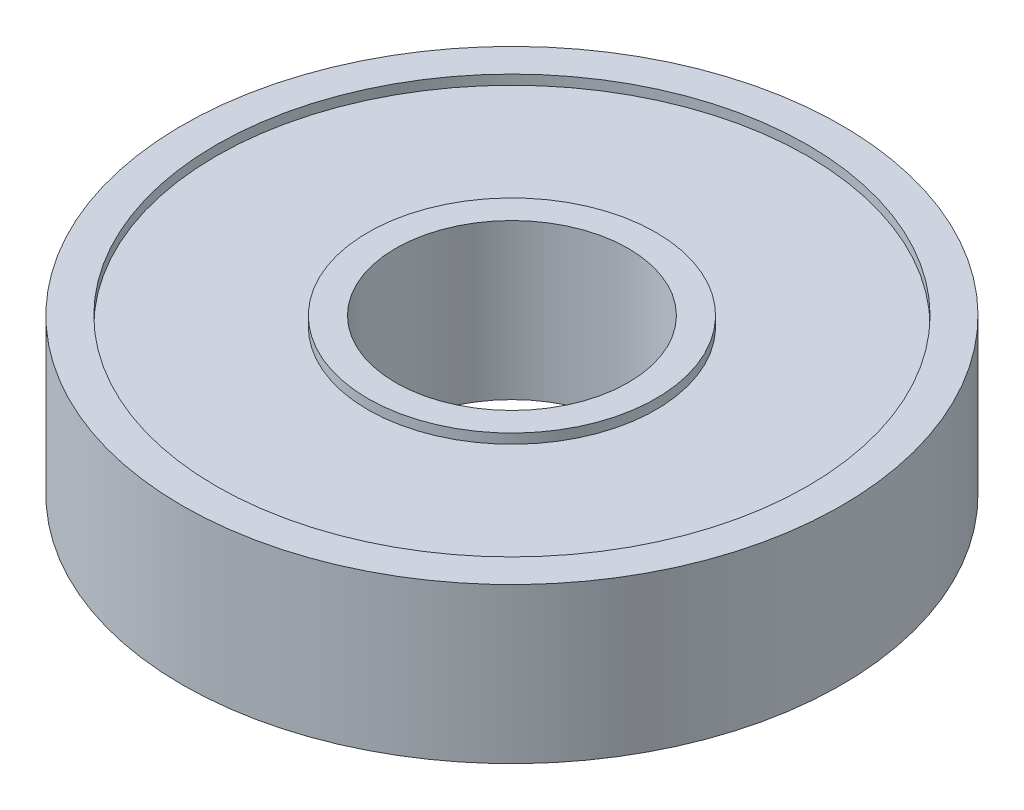
from build123d import *

# Parameters (mm, degrees)
SKETCH_1_R          = 17
SKETCH_1_R_2        = 6
EXTRUDE_1_DEPTH     = 8
SKETCH_2_R          = 15.251890777
SKETCH_2_R_2        = 7.427356703
CUT_EXTRUDE_2_DEPTH = 0.5
CUT_EXTRUDE_START   = -0.5
SKETCH_3_R          = 15.251890777
SKETCH_3_R_2        = 7.427356703
CUT_EXTRUDE_3_DEPTH = 0.5


with BuildPart() as part:
    # Эскиз1 → Вытянуть1 (new body)
    with BuildSketch(Plane(origin=(0, 0, 0), x_dir=(1, 0, 0), z_dir=(0, 1, 0))):
        with Locations(Location((0, 0, 0), (0, 0, 270))):
            Circle(SKETCH_1_R)
        with Locations(Location((0, 0, 0), (0, 0, 270))):
            Circle(SKETCH_1_R_2, mode=Mode.SUBTRACT)
    extrude(amount=EXTRUDE_1_DEPTH)

    # Эскиз2 → Вытянуть2 (cut)
    with BuildSketch(Plane(origin=(0, 8, 0), x_dir=(1, 0, 0), z_dir=(0, 1, 0))):
        with Locations(Location((0, 0, 0), (0, 0, 270))):
            Circle(SKETCH_2_R)
        with Locations(Location((0, 0, 0), (0, 0, 270))):
            Circle(SKETCH_2_R_2, mode=Mode.SUBTRACT)
    extrude(amount=-CUT_EXTRUDE_2_DEPTH, mode=Mode.SUBTRACT)

    # Эскиз3 → Вытянуть3 (cut)
    with BuildSketch(Plane.XZ.offset(CUT_EXTRUDE_START)):
        with Locations(Location((0, 0, 0), (0, 0, 90))):
            Circle(SKETCH_3_R)
        with Locations(Location((0, 0, 0), (0, 0, 90))):
            Circle(SKETCH_3_R_2, mode=Mode.SUBTRACT)
    extrude(amount=CUT_EXTRUDE_3_DEPTH, mode=Mode.SUBTRACT)


solid = part.part
